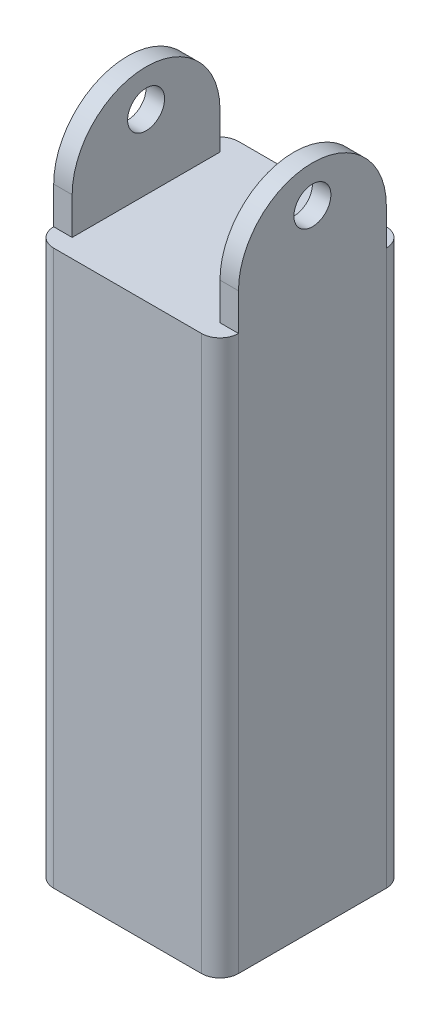
from build123d import *

# Parameters (mm, degrees)
SKETCH1_W                   = 100
SKETCH1_H                   = 100
BOSS_EXTRUDE1_DEPTH         = 300
FILLET1_R                   = 10
SKETCH5_W                   = 80
SKETCH5_H                   = 60
SKETCH5_R                   = 10
BOSS_EXTRUDE2_DEPTH         = 10
FILLET2_RADIUS              = 40
FILLET2_LENGTH              = 10
FILLET2_OF_MIRROR1_2_RADIUS = 40
FILLET2_OF_MIRROR1_2_LENGTH = 10


with BuildPart() as part:
    # Sketch1 → Boss-Extrude1 (new body)
    with BuildSketch(Plane(origin=(0, 0, 0), x_dir=(1, 0, 0), z_dir=(0, 1, 0))):
        Rectangle(SKETCH1_W, SKETCH1_H)
    extrude(amount=BOSS_EXTRUDE1_DEPTH)

    # Fillet1
    fillet1_edges = [part.edges().sort_by_distance(p)[0] for p in [
        (50, 150, 50),
        (-50, 150, 50),
        (-50, 150, -50),
        (50, 150, -50),
    ]]
    fillet(fillet1_edges, radius=FILLET1_R)

    # Sketch5 → Boss-Extrude2 (add)
    with BuildSketch(Plane(origin=(50, 0, 0), x_dir=(0, 0, -1), z_dir=(1, 0, 0))):
        with Locations((0, 330)):
            Rectangle(SKETCH5_W, SKETCH5_H)
        with Locations((0, 340)):
            Circle(SKETCH5_R, mode=Mode.SUBTRACT)
    boss_extrude2 = extrude(amount=-BOSS_EXTRUDE2_DEPTH)

    # Fillet2: full round fillet: the end face becomes a half cylinder, R = half its width
    fillet2_face = Plane((45, 360, 0), x_dir=(-1, 0, 0), z_dir=(0, 1, 0))  # on the end face: x along it, z out of the body
    fillet2_slab = fillet2_face.offset(-FILLET2_RADIUS / 2) * Box(FILLET2_LENGTH, 2 * FILLET2_RADIUS, FILLET2_RADIUS, mode=Mode.PRIVATE)  # the body's end, R deep
    fillet2_round = Plane((45, 320, 0), x_dir=(0, 1, 0), z_dir=(-1, 0, 0)) * Cylinder(FILLET2_RADIUS, FILLET2_LENGTH, mode=Mode.PRIVATE)  # its axis R under the face
    add(fillet2_slab - fillet2_round, mode=Mode.SUBTRACT)

    # Mirror1: Boss-Extrude2 across plane
    add(boss_extrude2.mirror(Plane(origin=(0, 0, 0), x_dir=(0, 0, 1), z_dir=(1, 0, 0))))

    # Fillet2 of Mirror1 2: full round fillet: the end face becomes a half cylinder, R = half its width
    fillet2_of_mirror1_2_face = Plane((-45, 360, 0), x_dir=(1, 0, 0), z_dir=(0, 1, 0))  # on the end face: x along it, z out of the body
    fillet2_of_mirror1_2_slab = fillet2_of_mirror1_2_face.offset(-FILLET2_OF_MIRROR1_2_RADIUS / 2) * Box(FILLET2_OF_MIRROR1_2_LENGTH, 2 * FILLET2_OF_MIRROR1_2_RADIUS, FILLET2_OF_MIRROR1_2_RADIUS, mode=Mode.PRIVATE)  # the body's end, R deep
    fillet2_of_mirror1_2_round = Plane((-45, 320, 0), x_dir=(0, 1, 0), z_dir=(1, 0, 0)) * Cylinder(FILLET2_OF_MIRROR1_2_RADIUS, FILLET2_OF_MIRROR1_2_LENGTH, mode=Mode.PRIVATE)  # its axis R under the face
    add(fillet2_of_mirror1_2_slab - fillet2_of_mirror1_2_round, mode=Mode.SUBTRACT)


solid = part.part
